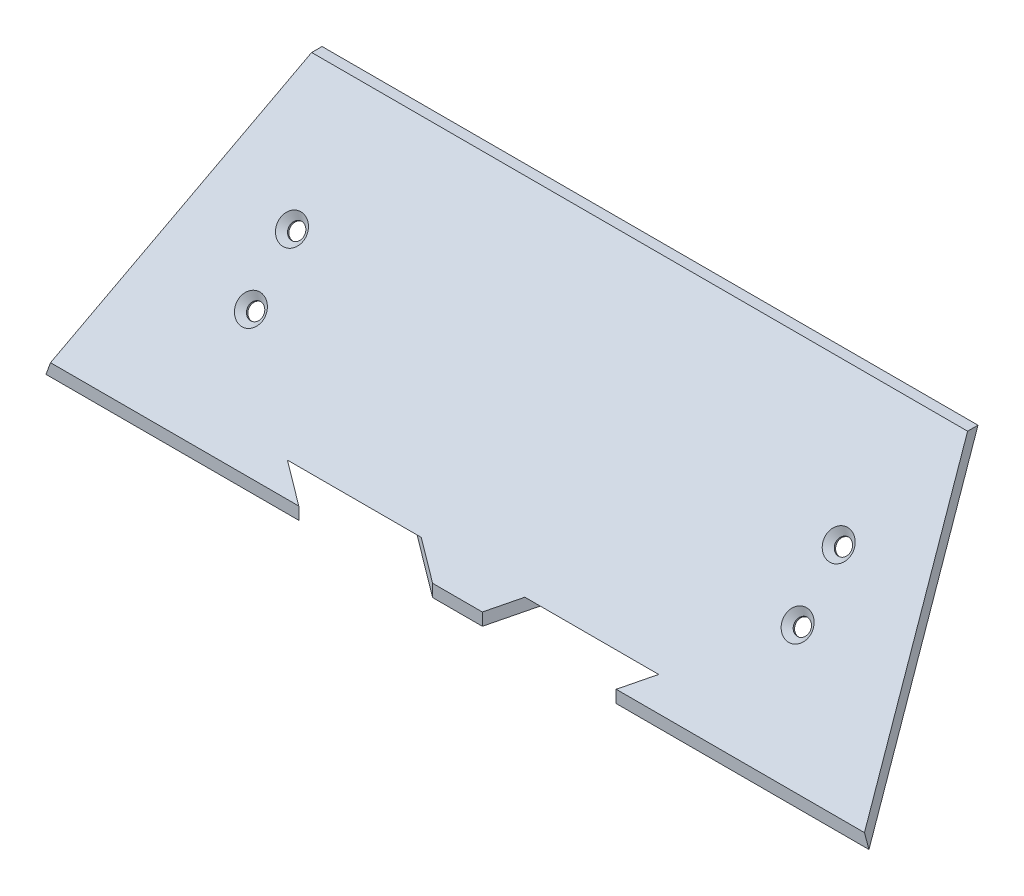
from build123d import *

# Parameters (mm, degrees)
BOSS_EXTRUDE1_DEPTH                             = 186.947944
CUT_EXTRUDE1_DEPTH                              = 202.219677631
CUT_EXTRUDE2_DEPTH                              = 119.891891944
CSK_FOR_M3_FLAT_HEAD_MACHINE_SCREW1_D           = 3.5
CSK_FOR_M3_FLAT_HEAD_MACHINE_SCREW1_DEPTH       = 5
CSK_FOR_M3_FLAT_HEAD_MACHINE_SCREW1_CSINK_D     = 6.3
CSK_FOR_M3_FLAT_HEAD_MACHINE_SCREW1_CSINK_ANGLE = 90
CUT_EXTRUDE3_REACH                              = 142.174
SKETCH7_W                                       = 15.2
SKETCH7_H                                       = 7
SKETCH7_H_2                                     = 1


with BuildPart() as part:
    # Sketch2 → Boss-Extrude1 (new body)
    with BuildSketch(Plane(origin=(0, 0, 0), x_dir=(0, 0, -1), z_dir=(1, 0, 0))):
        Polygon((0, 0), (-2.3622, 0), (45.480481789, 57.016687901), (47.842681789, 57.016687901), align=None)
    extrude(amount=BOSS_EXTRUDE1_DEPTH)

    # Sketch3 → Cut-Extrude1 (cut, through all)
    with BuildSketch(Plane.ZY):
        Polygon((-4.105707607, 4.89299179), (-4.105707607, 7.708152127), (2.3622, 0), (0, 0), align=None)
    extrude(amount=-CUT_EXTRUDE1_DEPTH, mode=Mode.SUBTRACT)

    # Sketch4 → Cut-Extrude2 (cut, through all)
    with BuildSketch(Plane(origin=(93.496468894, -1.981357522, -4.105707607), x_dir=(-1, 0, 0), z_dir=(0, 0, -1))):
        Polygon((93.496468894, 58.998045423), (74.524995009, 58.998045423), (93.496468894, 6.874349312), align=None)
        Polygon((-93.451475106, 6.874349312), (-93.451475106, 58.998045423), (-74.480001222, 58.998045423), align=None)
    extrude(amount=CUT_EXTRUDE2_DEPTH, mode=Mode.SUBTRACT)

    # CSK for M3 Flat Head Machine Screw1
    with Locations(Plane(origin=(0, 1.163156437, 1.386195863), x_dir=(1, 0, 0), z_dir=(0, 0.6427876096865435, 0.7660444431189745))):
        with Locations((31.377677493, 46.65493708), (31.377677493, 32.145498062)):
            csk_for_m3_flat_head_machine_screw1 = CounterSinkHole(CSK_FOR_M3_FLAT_HEAD_MACHINE_SCREW1_D / 2, CSK_FOR_M3_FLAT_HEAD_MACHINE_SCREW1_CSINK_D / 2, depth=CSK_FOR_M3_FLAT_HEAD_MACHINE_SCREW1_DEPTH, counter_sink_angle=CSK_FOR_M3_FLAT_HEAD_MACHINE_SCREW1_CSINK_ANGLE)

    # Mirror1: CSK for M3 Flat Head Machine Screw1 across plane
    add(csk_for_m3_flat_head_machine_screw1.mirror(Plane(origin=(93.473972, 0, 0), x_dir=(0, 0, 1), z_dir=(1, 0, 0))), mode=Mode.SUBTRACT)

    # Cut-Extrude3: up to this plane
    cut_extrude3_end = Plane(origin=(186.947944, 0, 2.3622), z_dir=(0, -0.6427876096865434, -0.7660444431189748))
    # Sketch7 → Cut-Extrude3 (cut, up to the surface)
    with BuildSketch(Plane(origin=(112.633038957, 0, -65.028715361), x_dir=(0.4999999999999981, -1.9080601945838373e-15, 0.8660254037844397), z_dir=(-0.8660254037844397, 3.3048572009189827e-15, 0.4999999999999981)), mode=Mode.PRIVATE) as cut_extrude3_sk1:
        with Locations((53.60637797, 8.418642478)):
            Rectangle(SKETCH7_W, SKETCH7_H)
    cut_extrude3_tool1 = split(extrude(cut_extrude3_sk1.sketch, amount=CUT_EXTRUDE3_REACH, mode=Mode.PRIVATE), bisect_by=cut_extrude3_end, keep=Keep.BOTH, mode=Mode.PRIVATE)
    # Sketch7 → Cut-Extrude3 (cut, up to the surface)
    with BuildSketch(Plane(origin=(112.633038957, 0, -65.028715361), x_dir=(0.4999999999999981, -1.9080601945838373e-15, 0.8660254037844397), z_dir=(-0.8660254037844397, 3.3048572009189827e-15, 0.4999999999999981)), mode=Mode.PRIVATE) as cut_extrude3_sk2:
        with Locations((53.60637797, 4.418642478)):
            Rectangle(SKETCH7_W, SKETCH7_H_2)
    cut_extrude3_tool2 = split(extrude(cut_extrude3_sk2.sketch, amount=CUT_EXTRUDE3_REACH, mode=Mode.PRIVATE), bisect_by=cut_extrude3_end, keep=Keep.BOTH, mode=Mode.PRIVATE)
    cut_extrude3 = cut_extrude3_tool1.solids().sort_by_distance((139.436228, 8.418642, -18.60423))[0] + cut_extrude3_tool2.solids().sort_by_distance((139.436228, 4.418642, -18.60423))[0]
    add(cut_extrude3, mode=Mode.SUBTRACT)

    # Mirror2: Cut-Extrude3 across plane
    add(cut_extrude3.mirror(Plane(origin=(93.473972, 0, 0), x_dir=(0, 0, 1), z_dir=(1, 0, 0))), mode=Mode.SUBTRACT)


solid = part.part
